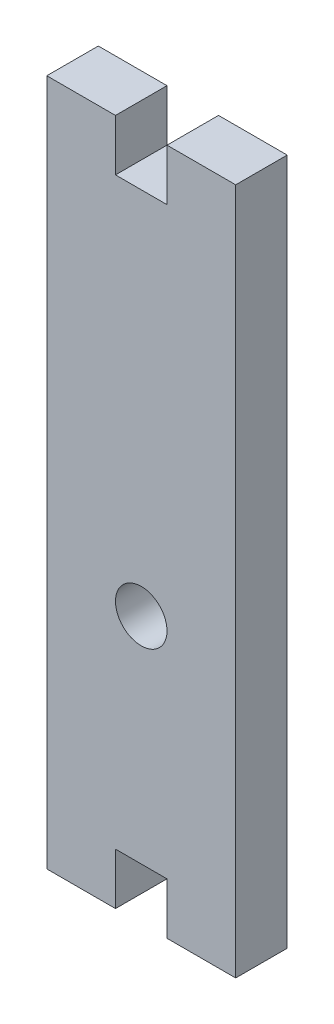
from build123d import *

# Parameters (mm, degrees)
ESQUISSE1_R        = 3
BOSS_EXTRU_1_DEPTH = 6


with BuildPart() as part:
    # Esquisse1 → Boss.-Extru.1 (new body)
    with BuildSketch(Plane.XY):
        Polygon((-14, 74), (-14, 80), (-22, 80), (-22, 0), (-14, 0), (-14, 6), (-8, 6), (-8, 0), (0, 0), (0, 80), (-8, 80), (-8, 74), align=None)
        with Locations((-11, 31)):
            Circle(ESQUISSE1_R, mode=Mode.SUBTRACT)
    extrude(amount=BOSS_EXTRU_1_DEPTH)


solid = part.part
